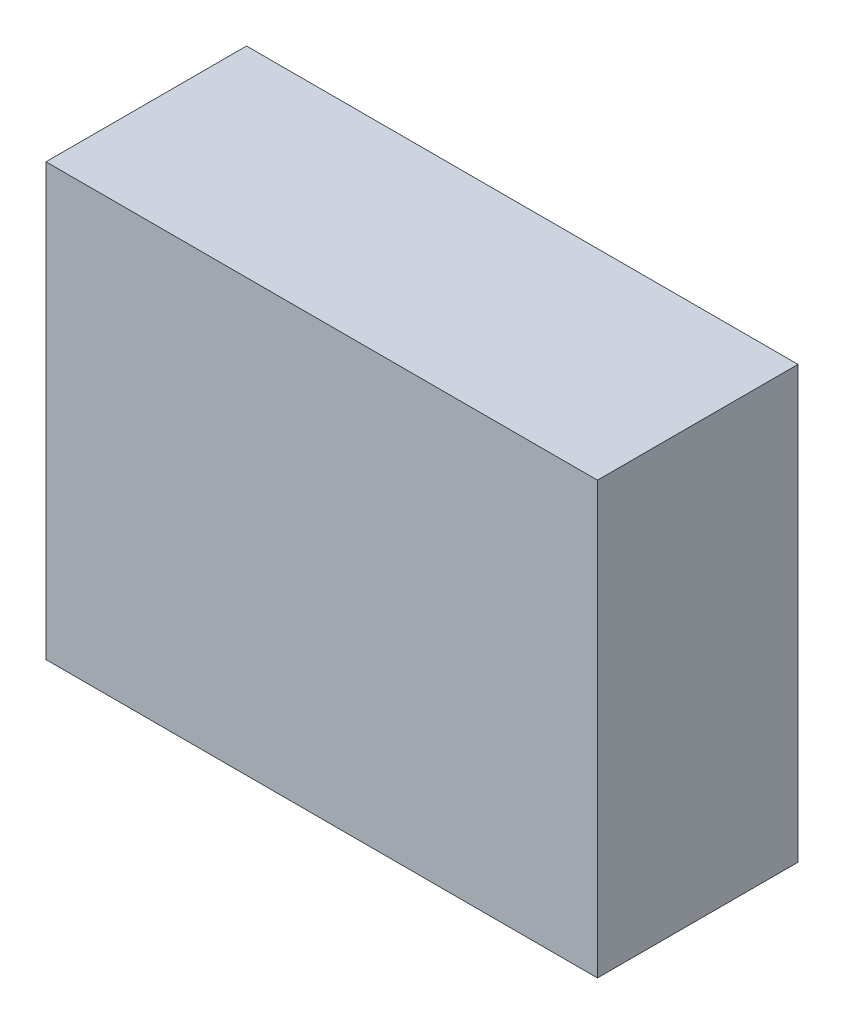
from build123d import *

# Parameters (mm, degrees)
SKETCH_1_W      = 55
SKETCH_1_H      = 43
EXTRUDE_1_DEPTH = 20


with BuildPart() as part:
    # 草图1 → 凸台-拉伸1 (new body)
    with BuildSketch(Plane.XY):
        with Locations((2.5, 1.5)):
            Rectangle(SKETCH_1_W, SKETCH_1_H)
    extrude(amount=EXTRUDE_1_DEPTH)


solid = part.part
